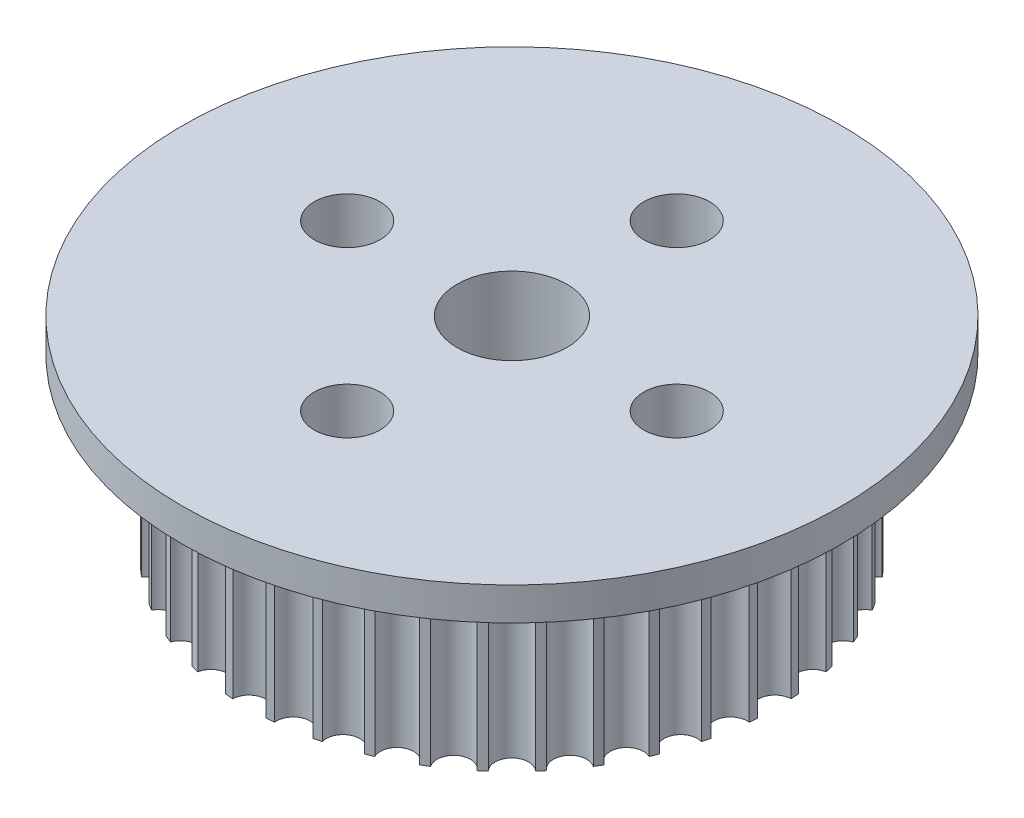
from build123d import *

# Parameters (mm, degrees)
BOSS_EXTRUDE1_DEPTH = 8
SKETCH2_R           = 15
BOSS_EXTRUDE2_DEPTH = 1.5
SKETCH4_R           = 2.5
CUT_EXTRUDE1_DEPTH  = 23
SKETCH5_R           = 1.5
CUT_EXTRUDE2_DEPTH  = 24.243278598


with BuildPart() as part:
    # Sketch1 → Boss-Extrude1 (new body)
    with BuildSketch(Plane(origin=(0, 0, 0), x_dir=(1, 0, 0), z_dir=(0, 1, 0))):
        with BuildLine():
            ThreePointArc((-2.619011045, 11.679969227), (-2.794341005, 11.639267947), (-2.969039138, 11.595934917))
            ThreePointArc((-2.969039138, 11.595934917), (-3.464080507, 10.661343548), (-4.413916411, 11.126465832))
            ThreePointArc((-4.413916411, 11.126465832), (-4.580720685, 11.058838004), (-4.746489215, 10.988709666))
            ThreePointArc((-4.746489215, 10.988709666), (-5.089233502, 9.988183136), (-6.100136506, 10.298991922))
            ThreePointArc((-6.100136506, 10.298991922), (-6.25430782, 10.206102767), (-6.407064974, 10.110905915))
            ThreePointArc((-6.407064974, 10.110905915), (-6.589072678, 9.069080507), (-7.636150994, 9.21792265))
            ThreePointArc((-7.636150994, 9.21792265), (-7.773893139, 9.102059408), (-7.909877531, 8.984138103))
            ThreePointArc((-7.909877531, 8.984138103), (-7.926667017, 7.926667017), (-8.984138103, 7.909877531))
            ThreePointArc((-8.984138103, 7.909877531), (-9.102059408, 7.773893139), (-9.21792265, 7.636150994))
            ThreePointArc((-9.21792265, 7.636150994), (-9.069080507, 6.589072678), (-10.110905915, 6.407064974))
            ThreePointArc((-10.110905915, 6.407064974), (-10.206102767, 6.25430782), (-10.298991922, 6.100136506))
            ThreePointArc((-10.298991922, 6.100136506), (-9.988183136, 5.089233502), (-10.988709666, 4.746489215))
            ThreePointArc((-10.988709666, 4.746489215), (-11.058838004, 4.580720685), (-11.126465832, 4.413916411))
            ThreePointArc((-11.126465832, 4.413916411), (-10.661343548, 3.464080507), (-11.595934917, 2.969039138))
            ThreePointArc((-11.595934917, 2.969039138), (-11.639267947, 2.794341005), (-11.679969227, 2.619011045))
            ThreePointArc((-11.679969227, 2.619011045), (-11.071986298, 1.753630353), (-11.917629765, 1.118481464))
            ThreePointArc((-11.917629765, 1.118481464), (-11.933100485, 0.939155376), (-11.945873016, 0.759616935))
            ThreePointArc((-11.945873016, 0.759616935), (-11.21, 0), (-11.945873016, -0.759616935))
            ThreePointArc((-11.945873016, -0.759616935), (-11.933100485, -0.939155376), (-11.917629765, -1.118481464))
            ThreePointArc((-11.917629765, -1.118481464), (-11.071986298, -1.753630353), (-11.679969227, -2.619011045))
            ThreePointArc((-11.679969227, -2.619011045), (-11.639267947, -2.794341005), (-11.595934917, -2.969039138))
            ThreePointArc((-11.595934917, -2.969039138), (-10.661343548, -3.464080507), (-11.126465832, -4.413916411))
            ThreePointArc((-11.126465832, -4.413916411), (-11.058838004, -4.580720685), (-10.988709666, -4.746489215))
            ThreePointArc((-10.988709666, -4.746489215), (-9.988183136, -5.089233502), (-10.298991922, -6.100136506))
            ThreePointArc((-10.298991922, -6.100136506), (-10.206102767, -6.25430782), (-10.110905915, -6.407064974))
            ThreePointArc((-10.110905915, -6.407064974), (-9.069080507, -6.589072678), (-9.21792265, -7.636150994))
            ThreePointArc((-9.21792265, -7.636150994), (-9.102059408, -7.773893139), (-8.984138103, -7.909877531))
            ThreePointArc((-8.984138103, -7.909877531), (-7.926667017, -7.926667017), (-7.909877531, -8.984138103))
            ThreePointArc((-7.909877531, -8.984138103), (-7.773893139, -9.102059408), (-7.636150994, -9.21792265))
            ThreePointArc((-7.636150994, -9.21792265), (-6.589072678, -9.069080507), (-6.407064974, -10.110905915))
            ThreePointArc((-6.407064974, -10.110905915), (-6.25430782, -10.206102767), (-6.100136506, -10.298991922))
            ThreePointArc((-6.100136506, -10.298991922), (-5.089233502, -9.988183136), (-4.746489215, -10.988709666))
            ThreePointArc((-4.746489215, -10.988709666), (-4.580720685, -11.058838004), (-4.413916411, -11.126465832))
            ThreePointArc((-4.413916411, -11.126465832), (-3.464080507, -10.661343548), (-2.969039138, -11.595934917))
            ThreePointArc((-2.969039138, -11.595934917), (-2.794341005, -11.639267947), (-2.619011045, -11.679969227))
            ThreePointArc((-2.619011045, -11.679969227), (-1.753630353, -11.071986298), (-1.118481464, -11.917629765))
            ThreePointArc((-1.118481464, -11.917629765), (-0.939155376, -11.933100485), (-0.759616935, -11.945873016))
            ThreePointArc((-0.759616935, -11.945873016), (0, -11.21), (0.759616935, -11.945873016))
            ThreePointArc((0.759616935, -11.945873016), (0.939155376, -11.933100485), (1.118481464, -11.917629765))
            ThreePointArc((1.118481464, -11.917629765), (1.753630353, -11.071986298), (2.619011045, -11.679969227))
            ThreePointArc((2.619011045, -11.679969227), (2.794341005, -11.639267947), (2.969039138, -11.595934917))
            ThreePointArc((2.969039138, -11.595934917), (3.464080507, -10.661343548), (4.413916411, -11.126465832))
            ThreePointArc((4.413916411, -11.126465832), (4.580720685, -11.058838004), (4.746489215, -10.988709666))
            ThreePointArc((4.746489215, -10.988709666), (5.089233502, -9.988183136), (6.100136506, -10.298991922))
            ThreePointArc((6.100136506, -10.298991922), (6.25430782, -10.206102767), (6.407064974, -10.110905915))
            ThreePointArc((6.407064974, -10.110905915), (6.589072678, -9.069080507), (7.636150994, -9.21792265))
            ThreePointArc((7.636150994, -9.21792265), (7.773893139, -9.102059408), (7.909877531, -8.984138103))
            ThreePointArc((7.909877531, -8.984138103), (7.926667017, -7.926667017), (8.984138103, -7.909877531))
            ThreePointArc((8.984138103, -7.909877531), (9.102059408, -7.773893139), (9.21792265, -7.636150994))
            ThreePointArc((9.21792265, -7.636150994), (9.069080507, -6.589072678), (10.110905915, -6.407064974))
            ThreePointArc((10.110905915, -6.407064974), (10.206102767, -6.25430782), (10.298991922, -6.100136506))
            ThreePointArc((10.298991922, -6.100136506), (9.988183136, -5.089233502), (10.988709666, -4.746489215))
            ThreePointArc((10.988709666, -4.746489215), (11.058838004, -4.580720685), (11.126465832, -4.413916411))
            ThreePointArc((11.126465832, -4.413916411), (10.661343548, -3.464080507), (11.595934917, -2.969039138))
            ThreePointArc((11.595934917, -2.969039138), (11.639267947, -2.794341005), (11.679969227, -2.619011045))
            ThreePointArc((11.679969227, -2.619011045), (11.071986298, -1.753630353), (11.917629765, -1.118481464))
            ThreePointArc((11.917629765, -1.118481464), (11.933100485, -0.939155376), (11.945873016, -0.759616935))
            ThreePointArc((11.945873016, -0.759616935), (11.21, 0), (11.945873016, 0.759616935))
            ThreePointArc((11.945873016, 0.759616935), (11.933100485, 0.939155376), (11.917629765, 1.118481464))
            ThreePointArc((11.917629765, 1.118481464), (11.071986298, 1.753630353), (11.679969227, 2.619011045))
            ThreePointArc((11.679969227, 2.619011045), (11.639267947, 2.794341005), (11.595934917, 2.969039138))
            ThreePointArc((11.595934917, 2.969039138), (10.661343548, 3.464080507), (11.126465832, 4.413916411))
            ThreePointArc((11.126465832, 4.413916411), (11.058838004, 4.580720685), (10.988709666, 4.746489215))
            ThreePointArc((10.988709666, 4.746489215), (9.988183136, 5.089233502), (10.298991922, 6.100136506))
            ThreePointArc((10.298991922, 6.100136506), (10.206102767, 6.25430782), (10.110905915, 6.407064974))
            ThreePointArc((10.110905915, 6.407064974), (9.069080507, 6.589072678), (9.21792265, 7.636150994))
            ThreePointArc((9.21792265, 7.636150994), (9.102059408, 7.773893139), (8.984138103, 7.909877531))
            ThreePointArc((8.984138103, 7.909877531), (7.926667017, 7.926667017), (7.909877531, 8.984138103))
            ThreePointArc((7.909877531, 8.984138103), (7.773893139, 9.102059408), (7.636150994, 9.21792265))
            ThreePointArc((7.636150994, 9.21792265), (6.589072678, 9.069080507), (6.407064974, 10.110905915))
            ThreePointArc((6.407064974, 10.110905915), (6.25430782, 10.206102767), (6.100136506, 10.298991922))
            ThreePointArc((6.100136506, 10.298991922), (5.089233502, 9.988183136), (4.746489215, 10.988709666))
            ThreePointArc((4.746489215, 10.988709666), (4.580720685, 11.058838004), (4.413916411, 11.126465832))
            ThreePointArc((4.413916411, 11.126465832), (3.464080507, 10.661343548), (2.969039138, 11.595934917))
            ThreePointArc((2.969039138, 11.595934917), (2.794341005, 11.639267947), (2.619011045, 11.679969227))
            ThreePointArc((2.619011045, 11.679969227), (1.753630353, 11.071986298), (1.118481464, 11.917629765))
            ThreePointArc((1.118481464, 11.917629765), (0.939155376, 11.933100485), (0.759616935, 11.945873016))
            ThreePointArc((0.759616935, 11.945873016), (0, 11.21), (-0.759616935, 11.945873016))
            ThreePointArc((-0.759616935, 11.945873016), (-0.939155376, 11.933100485), (-1.118481464, 11.917629765))
            ThreePointArc((-1.118481464, 11.917629765), (-1.753630353, 11.071986298), (-2.619011045, 11.679969227))
        make_face()
    extrude(amount=BOSS_EXTRUDE1_DEPTH)

    # Sketch2 → Boss-Extrude2 (add)
    with BuildSketch(Plane(origin=(0, 8, 0), x_dir=(1, 0, 0), z_dir=(0, 1, 0))):
        with Locations(Location((0, 0, 0), (0, 0, 270))):
            Circle(SKETCH2_R)
    extrude(amount=BOSS_EXTRUDE2_DEPTH)

    # Sketch4 → Cut-Extrude1 (cut)
    with BuildSketch(Plane.XZ):
        with Locations(Location((0, 0, 0), (0, 0, 270))):
            Circle(SKETCH4_R)
    extrude(amount=-CUT_EXTRUDE1_DEPTH, mode=Mode.SUBTRACT)

    # Sketch5 → Cut-Extrude2 (cut, through all)
    with BuildSketch(Plane.XZ):
        with Locations(Location((0, 7.5, 0), (0, 0, 270))):
            Circle(SKETCH5_R)
        with Locations(Location((7.5, 0, 0), (0, 0, 270))):
            Circle(SKETCH5_R)
        with Locations(Location((0, -7.5, 0), (0, 0, 270))):
            Circle(SKETCH5_R)
        with Locations(Location((-7.5, 0, 0), (0, 0, 270))):
            Circle(SKETCH5_R)
    extrude(amount=-CUT_EXTRUDE2_DEPTH, mode=Mode.SUBTRACT)


solid = part.part
